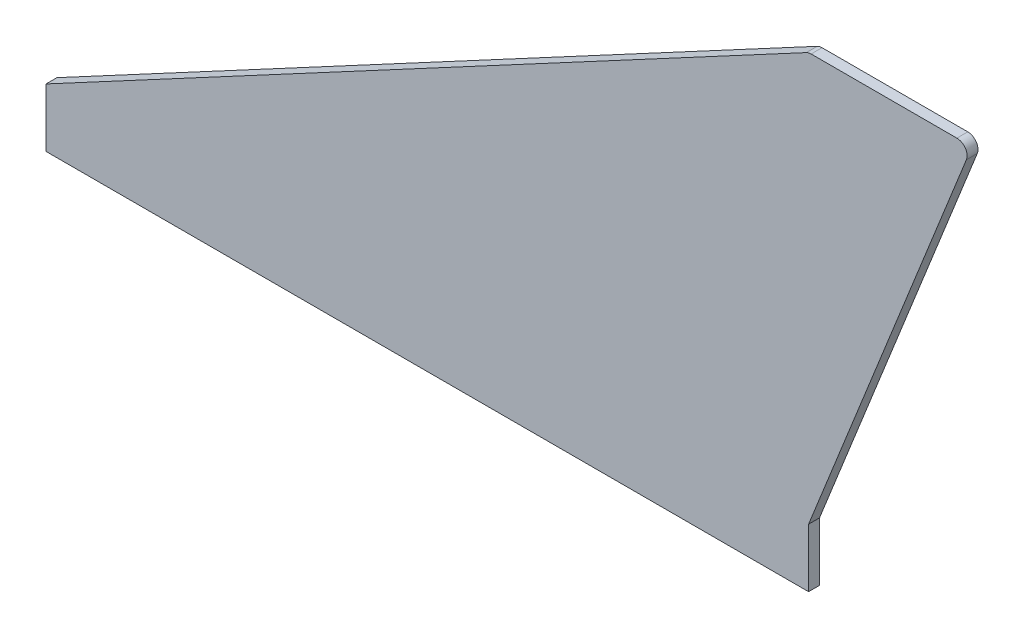
from build123d import *

# Parameters (mm, degrees)
FIN_BODY_DEPTH = 5.08
FIN_FILLETS_R  = 4.7625


with BuildPart() as part:
    # Fin Profile → Fin Body (new body)
    with BuildSketch(Plane.XY):
        Polygon((355.6, -27.2542), (0, -27.2542), (0, 0), (355.6, 190.5), (431.8, 190.5), (355.6, 0), align=None)
    extrude(amount=FIN_BODY_DEPTH)

    # Fin Fillets
    fin_fillets_edges = [part.edges().sort_by_distance(p)[0] for p in [
        (431.8, 190.5, 2.54),
        (355.6, 190.5, 2.54),
    ]]
    fillet(fin_fillets_edges, radius=FIN_FILLETS_R)


solid = part.part
